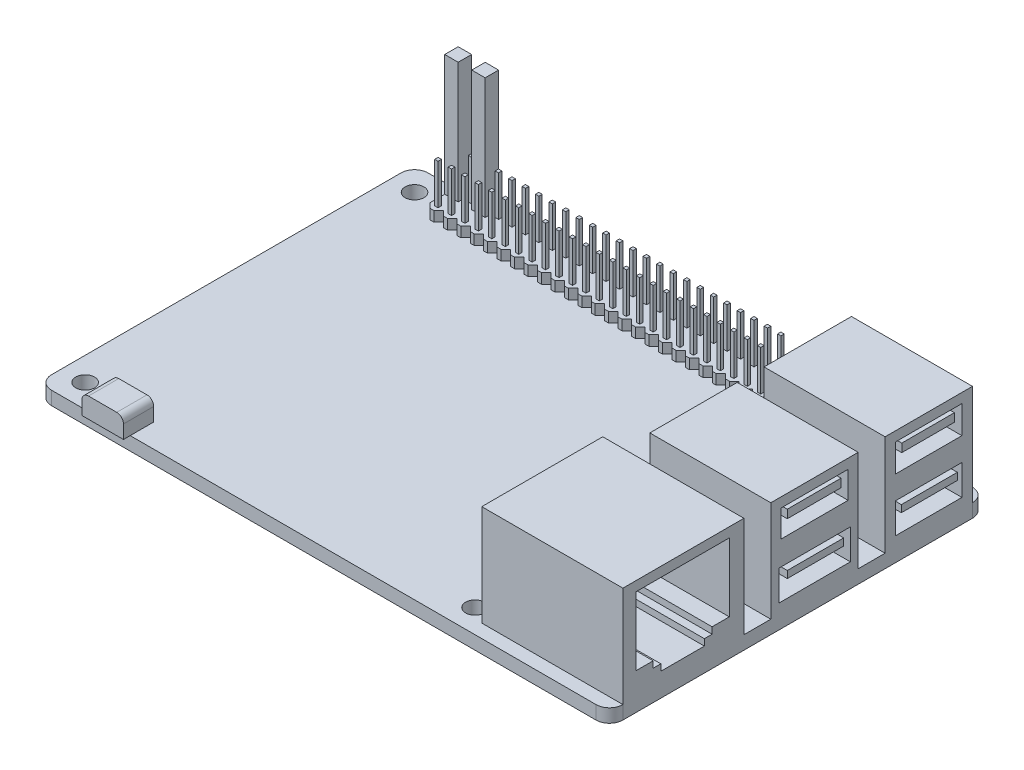
from build123d import *

# Parameters (mm, degrees)
SKETCH1_W           = 85
SKETCH1_H           = 56
BOSS_EXTRUDE1_DEPTH = 2
SKETCH2_W           = 18
SKETCH2_H           = 13
SKETCH2_W_2         = 21
SKETCH2_H_2         = 18
BOSS_EXTRUDE2_DEPTH = 15
SKETCH3_W           = 10
SKETCH3_H           = 4
SKETCH3_W_2         = 8
SKETCH3_H_2         = 1.23376522
SKETCH3_W_3         = 10.610380891
SKETCH3_H_3         = 4.503243053
SKETCH3_W_4         = 8.389603495
SKETCH3_H_4         = 1.048700437
SKETCH3_W_5         = 9.870121758
SKETCH3_H_5         = 4.133113486
SKETCH3_W_6         = 7.834409146
SKETCH3_W_7         = 8.327915233
CUT_EXTRUDE2_DEPTH  = 15
SKETCH4_R           = 1.4
CUT_EXTRUDE3_DEPTH  = 15
SKETCH5_W           = 6.2
SKETCH5_H           = 4.5
BOSS_EXTRUDE3_DEPTH = 3
FILLET1_R           = 1
BOSS_EXTRUDE6_DEPTH = 1.5
LPATTERN1_COUNT     = 25
LPATTERN1_PITCH     = 2
SKETCH9_W           = 0.5
SKETCH9_H           = 0.5
BOSS_EXTRUDE7_DEPTH = 6
SKETCH10_W          = 2
SKETCH10_H          = 2
BOSS_EXTRUDE8_DEPTH = 18
FILLET2_R           = 2


with BuildPart() as part:
    # Sketch1 → Boss-Extrude1 (new body)
    with BuildSketch(Plane(origin=(0, 0, 0), x_dir=(1, 0, 0), z_dir=(0, 1, 0))):
        Rectangle(SKETCH1_W, SKETCH1_H)
    extrude(amount=BOSS_EXTRUDE1_DEPTH)

    # Sketch2 → Boss-Extrude2 (add)
    with BuildSketch(Plane(origin=(0, 2, 0), x_dir=(1, 0, 0), z_dir=(0, 1, 0))):
        with Locations((33.5, 19.5)):
            Rectangle(SKETCH2_W, SKETCH2_H)
        with Locations((33.5, 2.5)):
            Rectangle(SKETCH2_W, SKETCH2_H)
        with Locations((32, -17)):
            Rectangle(SKETCH2_W_2, SKETCH2_H_2)
    extrude(amount=BOSS_EXTRUDE2_DEPTH)

    # Sketch3 → Cut-Extrude2 (cut)
    # profile 1 of 5: a face of its own
    with BuildSketch(Plane(origin=(42.5, 0, 0), x_dir=(0, 0, -1), z_dir=(1, 0, 0))):
        with Locations((2.5, 13.563318383)):
            Rectangle(SKETCH3_W, SKETCH3_H)
        with Locations((2.457805975, 14.329553164)):
            Rectangle(SKETCH3_W_2, SKETCH3_H_2, mode=Mode.SUBTRACT)
    # profile 2 of 5: a face of its own
    with BuildSketch(Plane(origin=(42.5, 0, 0), x_dir=(0, 0, -1), z_dir=(1, 0, 0))):
        with Locations((2.529231201, 5.724040756)):
            Rectangle(SKETCH3_W_3, SKETCH3_H_3)
        with Locations((2.652607722, 6.525988148)):
            Rectangle(SKETCH3_W_4, SKETCH3_H_4, mode=Mode.SUBTRACT)
    # profile 3 of 5: a face of its own
    with BuildSketch(Plane(origin=(42.5, 0, 0), x_dir=(0, 0, -1), z_dir=(1, 0, 0))):
        with Locations((19.493502973, 13.49676164)):
            Rectangle(SKETCH3_W_5, SKETCH3_H_5)
        with Locations((19.400970582, 14.329553164)):
            Rectangle(SKETCH3_W_6, SKETCH3_H_2, mode=Mode.SUBTRACT)
    # profile 4 of 5: a face of its own
    with BuildSketch(Plane(origin=(42.5, 0, 0), x_dir=(0, 0, -1), z_dir=(1, 0, 0))):
        with Locations((19.493502973, 5.724040756)):
            Rectangle(SKETCH3_W_5, SKETCH3_H_3)
        with Locations((19.586035365, 6.525988148)):
            Rectangle(SKETCH3_W_7, SKETCH3_H_4, mode=Mode.SUBTRACT)
    # profile 5 of 5: a face of its own
    with BuildSketch(Plane(origin=(42.5, 0, 0), x_dir=(0, 0, -1), z_dir=(1, 0, 0))):
        Polygon((-24.058409286, 15.563318383), (-10.178550563, 15.563318383), (-10.178550563, 5.390365481), (-12.734339015, 5.390365481), (-12.734339015, 4.431392355), (-13.879846223, 4.431392355), (-13.879846223, 3.472419229), (-20.357113627, 3.472419229), (-20.357113627, 4.431392355), (-21.502620835, 4.431392355), (-21.502620835, 5.390365481), (-24.058409286, 5.390365481), align=None)
    extrude(amount=-CUT_EXTRUDE2_DEPTH, mode=Mode.SUBTRACT)

    # Sketch4 → Cut-Extrude3 (cut)
    with BuildSketch(Plane(origin=(0, 2, 0), x_dir=(1, 0, 0), z_dir=(0, 1, 0))):
        with Locations(Location((-39, 24.5, 0), (0, 0, 270))):
            Circle(SKETCH4_R)
        with Locations(Location((-39, -24.5, 0), (0, 0, 270))):
            Circle(SKETCH4_R)
        with Locations(Location((19, -24.5, 0), (0, 0, 270))):
            Circle(SKETCH4_R)
        with Locations(Location((19, 24.5, 0), (0, 0, 270))):
            Circle(SKETCH4_R)
    extrude(amount=-CUT_EXTRUDE3_DEPTH, mode=Mode.SUBTRACT)

    # Sketch5 → Boss-Extrude3 (add)
    with BuildSketch(Plane(origin=(0, 2, 0), x_dir=(1, 0, 0), z_dir=(0, 1, 0))):
        with Locations((-31.9, -26.75)):
            Rectangle(SKETCH5_W, SKETCH5_H)
    extrude(amount=BOSS_EXTRUDE3_DEPTH)

    # Fillet1
    fillet1_edges = [part.edges().sort_by_distance(p)[0] for p in [
        (-35, 5, 26.75),
        (-28.8, 5, 26.75),
    ]]
    fillet(fillet1_edges, radius=FILLET1_R)

    # Sketch8 → Boss-Extrude6 (add)
    with BuildSketch(Plane(origin=(0, 2, 0), x_dir=(1, 0, 0), z_dir=(0, 1, 0))):
        Polygon((-34.292893219, 27), (-35, 26.292893219), (-35, 22.792893219), (-34.292893219, 22.085786438), (-33.707106781, 22.085786438), (-33, 22.792893219), (-33, 26.292893219), (-33.707106781, 27), align=None)
    boss_extrude6 = extrude(amount=BOSS_EXTRUDE6_DEPTH)

    # LPattern1: Boss-Extrude6 ×25
    with Locations(*[(i * LPATTERN1_PITCH, 0, 0) for i in range(1, LPATTERN1_COUNT)]):
        add(boss_extrude6)

    # Sketch9 → Boss-Extrude7 (add)
    with BuildSketch(Plane(origin=(0, 3.5, 0), x_dir=(1, 0, 0), z_dir=(0, 1, 0))):
        with Locations((-34, 26)):
            Rectangle(SKETCH9_W, SKETCH9_H)
        with Locations((-32, 26)):
            Rectangle(SKETCH9_W, SKETCH9_H)
        with Locations((-30, 26)):
            Rectangle(SKETCH9_W, SKETCH9_H)
        with Locations((-28, 26)):
            Rectangle(SKETCH9_W, SKETCH9_H)
        with Locations((-26, 26)):
            Rectangle(SKETCH9_W, SKETCH9_H)
        with Locations((-24, 26)):
            Rectangle(SKETCH9_W, SKETCH9_H)
        with Locations((-22, 26)):
            Rectangle(SKETCH9_W, SKETCH9_H)
        with Locations((-20, 26)):
            Rectangle(SKETCH9_W, SKETCH9_H)
        with Locations((-18, 26)):
            Rectangle(SKETCH9_W, SKETCH9_H)
        with Locations((-16, 26)):
            Rectangle(SKETCH9_W, SKETCH9_H)
        with Locations((-14, 26)):
            Rectangle(SKETCH9_W, SKETCH9_H)
        with Locations((-12, 26)):
            Rectangle(SKETCH9_W, SKETCH9_H)
        with Locations((-10, 26)):
            Rectangle(SKETCH9_W, SKETCH9_H)
        with Locations((-8, 26)):
            Rectangle(SKETCH9_W, SKETCH9_H)
        with Locations((-6, 26)):
            Rectangle(SKETCH9_W, SKETCH9_H)
        with Locations((-4, 26)):
            Rectangle(SKETCH9_W, SKETCH9_H)
        with Locations((-2, 26)):
            Rectangle(SKETCH9_W, SKETCH9_H)
        with Locations((0, 26)):
            Rectangle(SKETCH9_W, SKETCH9_H)
        with Locations((2, 26)):
            Rectangle(SKETCH9_W, SKETCH9_H)
        with Locations((4, 26)):
            Rectangle(SKETCH9_W, SKETCH9_H)
        with Locations((6, 26)):
            Rectangle(SKETCH9_W, SKETCH9_H)
        with Locations((8, 26)):
            Rectangle(SKETCH9_W, SKETCH9_H)
        with Locations((10, 26)):
            Rectangle(SKETCH9_W, SKETCH9_H)
        with Locations((12, 26)):
            Rectangle(SKETCH9_W, SKETCH9_H)
        with Locations((14, 26)):
            Rectangle(SKETCH9_W, SKETCH9_H)
        with Locations((-32, 23)):
            Rectangle(SKETCH9_W, SKETCH9_H)
        with Locations((-30, 23)):
            Rectangle(SKETCH9_W, SKETCH9_H)
        with Locations((-28, 23)):
            Rectangle(SKETCH9_W, SKETCH9_H)
        with Locations((-26, 23)):
            Rectangle(SKETCH9_W, SKETCH9_H)
        with Locations((-24, 23)):
            Rectangle(SKETCH9_W, SKETCH9_H)
        with Locations((-22, 23)):
            Rectangle(SKETCH9_W, SKETCH9_H)
        with Locations((-20, 23)):
            Rectangle(SKETCH9_W, SKETCH9_H)
        with Locations((-18, 23)):
            Rectangle(SKETCH9_W, SKETCH9_H)
        with Locations((-16, 23)):
            Rectangle(SKETCH9_W, SKETCH9_H)
        with Locations((-14, 23)):
            Rectangle(SKETCH9_W, SKETCH9_H)
        with Locations((-12, 23)):
            Rectangle(SKETCH9_W, SKETCH9_H)
        with Locations((-10, 23)):
            Rectangle(SKETCH9_W, SKETCH9_H)
        with Locations((-8, 23)):
            Rectangle(SKETCH9_W, SKETCH9_H)
        with Locations((-6, 23)):
            Rectangle(SKETCH9_W, SKETCH9_H)
        with Locations((-4, 23)):
            Rectangle(SKETCH9_W, SKETCH9_H)
        with Locations((-2, 23)):
            Rectangle(SKETCH9_W, SKETCH9_H)
        with Locations((0, 23)):
            Rectangle(SKETCH9_W, SKETCH9_H)
        with Locations((2, 23)):
            Rectangle(SKETCH9_W, SKETCH9_H)
        with Locations((4, 23)):
            Rectangle(SKETCH9_W, SKETCH9_H)
        with Locations((6, 23)):
            Rectangle(SKETCH9_W, SKETCH9_H)
        with Locations((8, 23)):
            Rectangle(SKETCH9_W, SKETCH9_H)
        with Locations((10, 23)):
            Rectangle(SKETCH9_W, SKETCH9_H)
        with Locations((12, 23)):
            Rectangle(SKETCH9_W, SKETCH9_H)
        with Locations((14, 23)):
            Rectangle(SKETCH9_W, SKETCH9_H)
        with Locations((-34, 23)):
            Rectangle(SKETCH9_W, SKETCH9_H)
    extrude(amount=BOSS_EXTRUDE7_DEPTH)

    # Sketch10 → Boss-Extrude8 (add)
    with BuildSketch(Plane(origin=(0, 3.5, 0), x_dir=(1, 0, 0), z_dir=(0, 1, 0))):
        with Locations((-34.007774712, 26)):
            Rectangle(SKETCH10_W, SKETCH10_H)
        with Locations((-29.992225288, 26)):
            Rectangle(SKETCH10_W, SKETCH10_H)
    extrude(amount=BOSS_EXTRUDE8_DEPTH)

    # Fillet2
    fillet2_edges = [part.edges().sort_by_distance(p)[0] for p in [
        (-42.5, 1, -28),
        (42.5, 1, -28),
        (42.5, 1, 28),
        (-42.5, 1, 28),
    ]]
    fillet(fillet2_edges, radius=FILLET2_R)


solid = part.part
